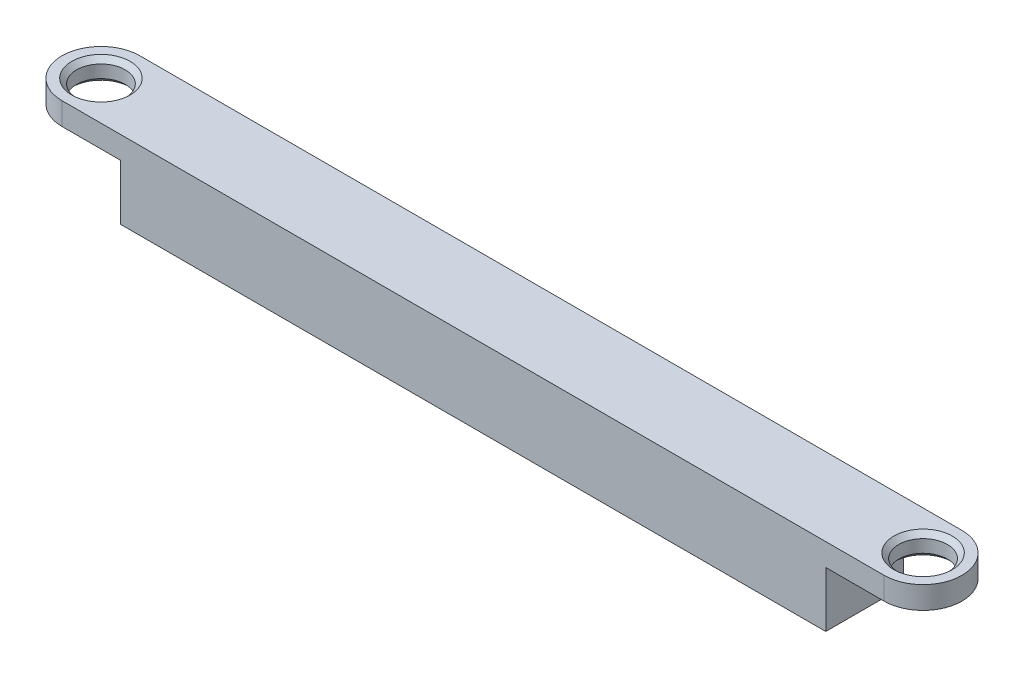
from build123d import *

# Parameters (mm, degrees)
SKETCH1_W           = 72.5
SKETCH1_H           = 8
BOSS_EXTRUDE1_DEPTH = 8
SKETCH2_W           = 4
SKETCH2_H           = 1
EXTRUDE_THIN1_DEPTH = 1
LPATTERN1_COUNT     = 8
LPATTERN1_PITCH     = 4.5
LPATTERN1_COL_COUNT = 9
LPATTERN1_COL_PITCH = 4.5
SKETCH3_W           = 8
SKETCH3_H           = 2.3
BOSS_EXTRUDE2_DEPTH = 12
SKETCH4_OUTSIDE_W   = 117.95
SKETCH4_OUTSIDE_H   = 29.45
SKETCH4_OUTSIDE_R   = 2.5
CUT_EXTRUDE1_DEPTH  = 50.729895435
CHAMFER1_SIZE       = 0.5


with BuildPart() as part:
    # Sketch1 → Boss-Extrude1 (new body)
    with BuildSketch(Plane.XY):
        Rectangle(SKETCH1_W, SKETCH1_H)
    extrude(amount=BOSS_EXTRUDE1_DEPTH)

    # Sketch2 → Extrude-Thin1 (add)
    with BuildSketch(Plane.XZ.offset(4)):
        with Locations((-2.25, 0.5)):
            Rectangle(SKETCH2_W, SKETCH2_H)
    extrude_thin1 = extrude(amount=EXTRUDE_THIN1_DEPTH)

    # LPattern1: Extrude-Thin1 ×8
    with Locations(*[(-i * LPATTERN1_PITCH, 0, 0) for i in range(1, LPATTERN1_COUNT)]):
        add(extrude_thin1)

    # LPattern1 col: Extrude-Thin1 ×9
    with Locations(*[(i * LPATTERN1_COL_PITCH, 0, 0) for i in range(1, LPATTERN1_COL_COUNT)]):
        add(extrude_thin1)

    # Sketch3 → Boss-Extrude2 (add)
    with BuildSketch(Plane(origin=(36.25, 0, 0), x_dir=(0, 0, -1), z_dir=(1, 0, 0))):
        with Locations((-4, 2.85)):
            Rectangle(SKETCH3_W, SKETCH3_H)
    boss_extrude2 = extrude(amount=BOSS_EXTRUDE2_DEPTH)

    # Mirror1: Boss-Extrude2 across plane
    add(boss_extrude2.mirror(Plane(origin=(0, 0, 0), x_dir=(0, 0, 1), z_dir=(1, 0, 0))))

    # Sketch4 outside → Cut-Extrude1 (cut, through all)
    # profile 1 of 3: a face of its own
    with BuildSketch(Plane(origin=(0, 4, 0), x_dir=(1, 0, 0), z_dir=(0, 1, 0))):
        with Locations((0, -4)):
            Rectangle(SKETCH4_OUTSIDE_W, SKETCH4_OUTSIDE_H)
        with BuildLine():
            Line((-42.25, 0), (42.25, 0))
            ThreePointArc((42.25, 0), (46.25, -4), (42.25, -8))
            Line((42.25, -8), (-42.25, -8))
            ThreePointArc((-42.25, -8), (-46.25, -4), (-42.25, 0))
        make_face(mode=Mode.SUBTRACT)
    # profile 2 of 3: a face of its own
    with BuildSketch(Plane(origin=(0, 4, 0), x_dir=(1, 0, 0), z_dir=(0, 1, 0))):
        with Locations(Location((-42.25, -4, 0), (0, 0, 270))):
            Circle(SKETCH4_OUTSIDE_R)
    # profile 3 of 3: a face of its own
    with BuildSketch(Plane(origin=(0, 4, 0), x_dir=(1, 0, 0), z_dir=(0, 1, 0))):
        with Locations(Location((42.25, -4, 0), (0, 0, 270))):
            Circle(SKETCH4_OUTSIDE_R)
    extrude(amount=-CUT_EXTRUDE1_DEPTH, mode=Mode.SUBTRACT)

    # Chamfer1
    chamfer1_edges = [part.edges().sort_by_distance(p)[0] for p in [
        (42.25, 1.7, 1.5),
        (42.25, 4, 1.5),
        (-42.25, 1.7, 1.5),
        (-42.25, 4, 1.5),
    ]]
    chamfer(chamfer1_edges, length=CHAMFER1_SIZE)


solid = part.part
